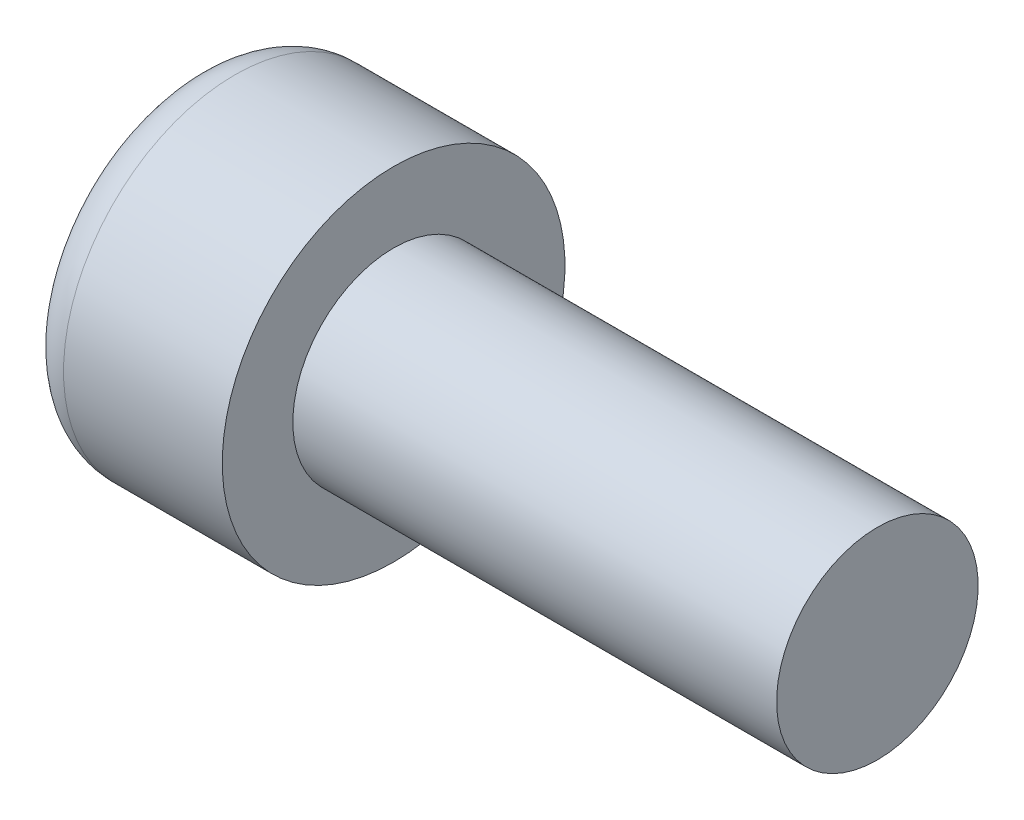
from build123d import *

# Parameters (mm, degrees)
CUT_EXTRUDE1_DEPTH = 2.5


with BuildPart() as part:
    # Sketch1 → Revolve1 (revolve)
    with BuildSketch(Plane.XY, mode=Mode.PRIVATE) as revolve1_sk:
        with BuildLine():
            Line((0, 0), (0, 3.1875))
            ThreePointArc((0, 3.1875), (0.311199045, 3.938800955), (1.0625, 4.25))
            Line((1.0625, 4.25), (5, 4.25))
            Line((5, 4.25), (5, 2.5))
            Line((5, 2.5), (17, 2.5))
            Line((17, 2.5), (17, 0))
            Line((17, 0), (0, 0))
        make_face()
    revolve(revolve1_sk.sketch.rotate(Axis((0, 0, 0), (1, 0, 0)), 180), axis=Axis((0, 0, 0), (1, 0, 0)))

    # Sketch2 → Cut-Extrude1 (cut)
    with BuildSketch(Plane.ZY):
        Polygon((0, 2.309401077), (-2, 1.154700538), (-2, -1.154700538), (0, -2.309401077), (2, -1.154700538), (2, 1.154700538), align=None)
    extrude(amount=-CUT_EXTRUDE1_DEPTH, mode=Mode.SUBTRACT)


solid = part.part
